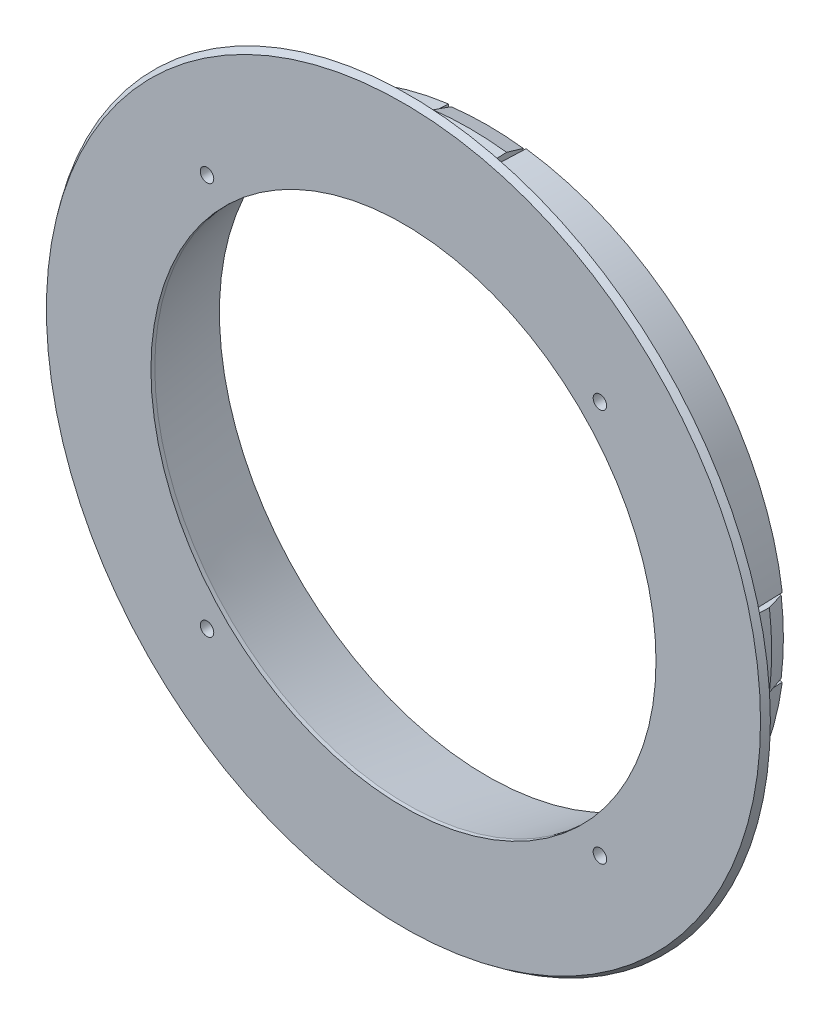
from build123d import *
from build123d.topology import SkipClean

# Parameters (mm, degrees)
CLAMP_CUTOFF_ANGLE = 15
CLAMP_BODY_ANGLE   = 14
CLAMP_ARRAY_COUNT  = 4
HOLES_ARRAY_COUNT  = 4


with BuildPart() as part:
    # Main_profile → Main_body (revolve)
    with BuildSketch(Plane(origin=(0, 0, 0), x_dir=(1, 0, 0), z_dir=(0, 1, 0))):
        Polygon((-75, 1.2), (-74.159750954, 0), (-52.45, 0), (-52.45, 0.8), (-55.629352876, 17.4), (-61.8, 17.4), (-62.5, 1.2), align=None)
    revolve(axis=Axis((0, 0, 21.596985385), (0, 0, -1)))

    # Эскиз1<8> → clamp_cutoff (revolve, symmetric, cut)
    with BuildSketch(Plane(origin=(0, 0, 0), x_dir=(1, 0, 0), z_dir=(0, 1, 0))) as clamp_cutoff_sk:
        Polygon((-62.333436307, 5.054759753), (-59.933436307, 5.054759753), (-59.333436307, 17.4), (-61.8, 17.4), align=None)
    clamp_cutoff = revolve(axis=Axis((0, 0, 21.596985385), (0, 0, -1)), revolution_arc=CLAMP_CUTOFF_ANGLE / 2, mode=Mode.SUBTRACT)
    clamp_cutoff = clamp_cutoff + revolve(clamp_cutoff_sk.sketch, axis=Axis((0, 0, 21.596985385), (0, 0, 1)), revolution_arc=CLAMP_CUTOFF_ANGLE / 2, mode=Mode.SUBTRACT)

    # Эскиз1<10> → Clamp_body (revolve, symmetric)
    with SkipClean():  # the faces are left unmerged after this step: merging them gives an invalid solid
        with BuildSketch(Plane(origin=(0, 0, 0), x_dir=(1, 0, 0), z_dir=(0, 1, 0))) as clamp_body_sk:
            Polygon((-62.307188758, 5.662203024), (-62.333436307, 5.054759753), (-60.333436307, 5.054759753), (-60.333436307, 17.4), (-61.50694686, 17.4), (-62.7, 13.77307305), align=None)
        clamp_body = revolve(axis=Axis((0, 0, 21.596985385), (0, 0, -1)), revolution_arc=CLAMP_BODY_ANGLE / 2)
        clamp_body = clamp_body + revolve(clamp_body_sk.sketch, axis=Axis((0, 0, 21.596985385), (0, 0, 1)), revolution_arc=CLAMP_BODY_ANGLE / 2)

    # Clamp_array: clamp_cutoff, Clamp_body ×4 about axis
    with SkipClean():  # the faces are left unmerged after this step: merging them gives an invalid solid
        clamp_array_axis = Axis((0, 0, -17.4), (0, 0, 1))
        add([clamp_cutoff.rotate(clamp_array_axis, i * 360 / CLAMP_ARRAY_COUNT) for i in range(1, CLAMP_ARRAY_COUNT)], mode=Mode.SUBTRACT)
        add([clamp_body.rotate(clamp_array_axis, i * 360 / CLAMP_ARRAY_COUNT) for i in range(1, CLAMP_ARRAY_COUNT)])

    # Hole_profile → Hole (revolve, cut)
    with SkipClean():  # the faces are left unmerged after this step: merging them gives an invalid solid
        with BuildSketch(Plane(origin=(0, 0, 0), x_dir=(0, 0, -1), z_dir=(0.7071067811865488, 0.7071067811865464, 0))):
            Polygon((0, 59.1), (0, 57.7), (15, 57.7), (13.441154273, 58.6), align=None)
        hole = revolve(axis=Axis((-40.800061274, 40.800061274, 2.268978304), (0, 0, -1)), mode=Mode.SUBTRACT)

    # Holes_array: Hole ×4 about axis
    with SkipClean():  # the faces are left unmerged after this step: merging them gives an invalid solid
        holes_array_axis = Axis((0, 0, 0), (0, 0, 1))
        for i in range(1, HOLES_ARRAY_COUNT):
            add(hole.rotate(holes_array_axis, i * 360 / HOLES_ARRAY_COUNT), mode=Mode.SUBTRACT)


solid = part.part
